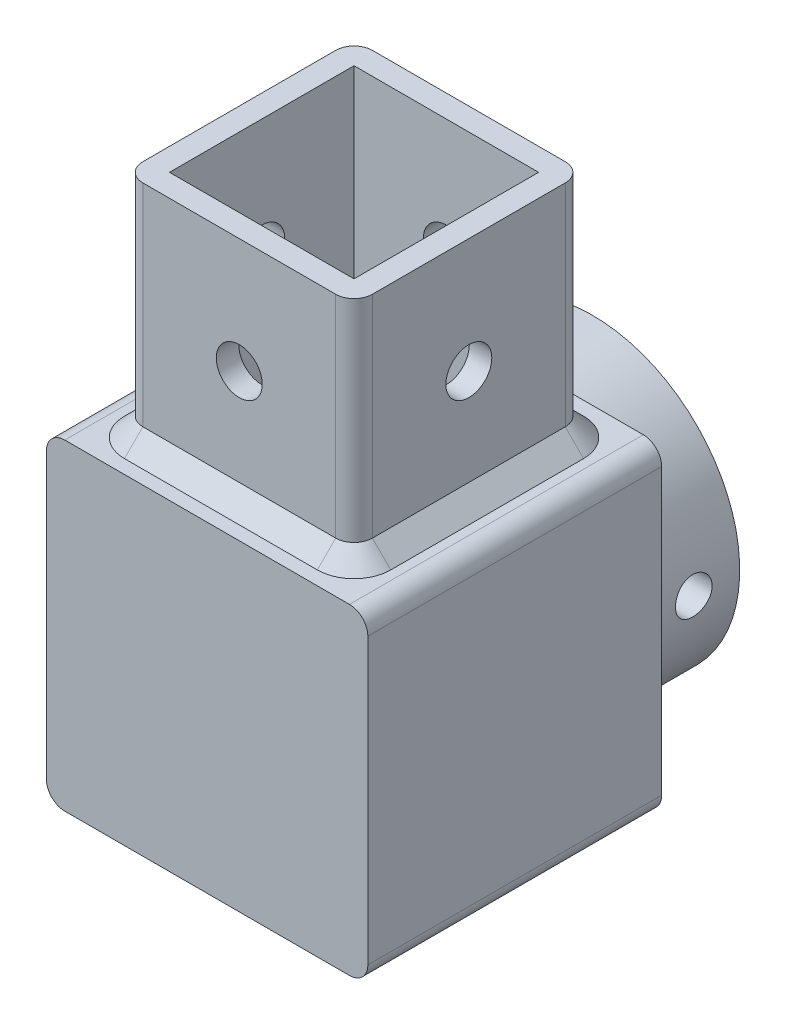
from build123d import *

# Parameters (mm, degrees)
SKETCH1_W           = 35
SKETCH1_H           = 35
BOSS_EXTRUDE1_DEPTH = 32
SKETCH2_R           = 16
SKETCH2_R_2         = 10.1
BOSS_EXTRUDE2_DEPTH = 10
SKETCH3_R           = 10
CUT_EXTRUDE1_DEPTH  = 25
SKETCH4_R           = 2
CUT_EXTRUDE2_DEPTH  = 20
SKETCH5_R           = 2
CUT_EXTRUDE3_DEPTH  = 20
SKETCH6_W           = 25
SKETCH6_H           = 25
SKETCH6_W_2         = 20.1
SKETCH6_H_2         = 20.1
BOSS_EXTRUDE3_DEPTH = 25
SKETCH7_R           = 2.5
CUT_EXTRUDE4_DEPTH  = 60.956234102
SKETCH8_R           = 2.5
CUT_EXTRUDE5_DEPTH  = 25
FILLET1_R           = 2
FILLET2_R           = 2
FILLET3_R           = 1
CHAMFER1_SIZE       = 2


with BuildPart() as part:
    # Sketch1 → Boss-Extrude1 (new body)
    with BuildSketch(Plane.XY):
        Rectangle(SKETCH1_W, SKETCH1_H)
    extrude(amount=BOSS_EXTRUDE1_DEPTH)

    # Sketch2 → Boss-Extrude2 (add)
    with BuildSketch(Plane(origin=(0, 0, 0), x_dir=(-1, 0, 0), z_dir=(0, 0, -1))):
        Circle(SKETCH2_R)
        Circle(SKETCH2_R_2, mode=Mode.SUBTRACT)
    extrude(amount=BOSS_EXTRUDE2_DEPTH)

    # Sketch3 → Cut-Extrude1 (cut)
    with BuildSketch(Plane(origin=(0, 0, 0), x_dir=(-1, 0, 0), z_dir=(0, 0, -1))):
        Circle(SKETCH3_R)
    extrude(amount=-CUT_EXTRUDE1_DEPTH, mode=Mode.SUBTRACT)

    # Sketch4 → Cut-Extrude2 (cut, symmetric)
    with BuildSketch(Plane(origin=(0, 0, 0), x_dir=(1, 0, 0), z_dir=(0, 1, 0))):
        with Locations(Location((0, 5, 0), (0, 0, 270))):
            Circle(SKETCH4_R)
    extrude(amount=CUT_EXTRUDE2_DEPTH, both=True, mode=Mode.SUBTRACT)

    # Sketch5 → Cut-Extrude3 (cut, symmetric)
    with BuildSketch(Plane(origin=(0, 0, 0), x_dir=(0, 0, -1), z_dir=(1, 0, 0))):
        with Locations((5, 0)):
            Circle(SKETCH5_R)
    extrude(amount=CUT_EXTRUDE3_DEPTH, both=True, mode=Mode.SUBTRACT)

    # Sketch6 → Boss-Extrude3 (add)
    with BuildSketch(Plane(origin=(0, 17.5, 0), x_dir=(1, 0, 0), z_dir=(0, 1, 0))):
        with Locations((0, -16)):
            Rectangle(SKETCH6_W, SKETCH6_H)
        with Locations((0, -16)):
            Rectangle(SKETCH6_W_2, SKETCH6_H_2, mode=Mode.SUBTRACT)
    extrude(amount=BOSS_EXTRUDE3_DEPTH)

    # Sketch7 → Cut-Extrude4 (cut, through all)
    with BuildSketch(Plane.XY.offset(28.5)):
        with Locations((0, 30)):
            Circle(SKETCH7_R)
    extrude(amount=-CUT_EXTRUDE4_DEPTH, mode=Mode.SUBTRACT)

    # Sketch8 → Cut-Extrude5 (cut)
    with BuildSketch(Plane(origin=(12.5, 0, 0), x_dir=(0, 0, -1), z_dir=(1, 0, 0))):
        with Locations((-16, 30)):
            Circle(SKETCH8_R)
    extrude(amount=-CUT_EXTRUDE5_DEPTH, mode=Mode.SUBTRACT)

    # Fillet1
    fillet1_edges = [part.edges().sort_by_distance(p)[0] for p in [
        (-12.5, 30, 3.5),
        (-12.5, 30, 28.5),
        (12.5, 30, 28.5),
        (12.5, 30, 3.5),
        (-17.5, 17.5, 16),
        (17.5, 17.5, 16),
    ]]
    fillet(fillet1_edges, radius=FILLET1_R)

    # Fillet2
    fillet2_edges = [part.edges().sort_by_distance(p)[0] for p in [
        (17.5, -17.5, 16),
        (-17.5, -17.5, 16),
    ]]
    fillet(fillet2_edges, radius=FILLET2_R)

    # Fillet3
    fillet3_edges = [part.edges().sort_by_distance(p)[0] for p in [
        (16, 0, 0),
    ]]
    fillet(fillet3_edges, radius=FILLET3_R)

    # Chamfer1
    chamfer1_edges = [part.edges().sort_by_distance(p)[0] for p in [
        (-12.5, 17.5, 16),
        (0, 17.5, 3.5),
        (12.5, 17.5, 16),
        (0, 17.5, 28.5),
        (11.914213562, 17.5, 27.914213562),
        (11.914213562, 17.5, 4.085786438),
        (-11.914213562, 17.5, 4.085786438),
        (-11.914213562, 17.5, 27.914213562),
    ]]
    chamfer(chamfer1_edges, length=CHAMFER1_SIZE)


solid = part.part
